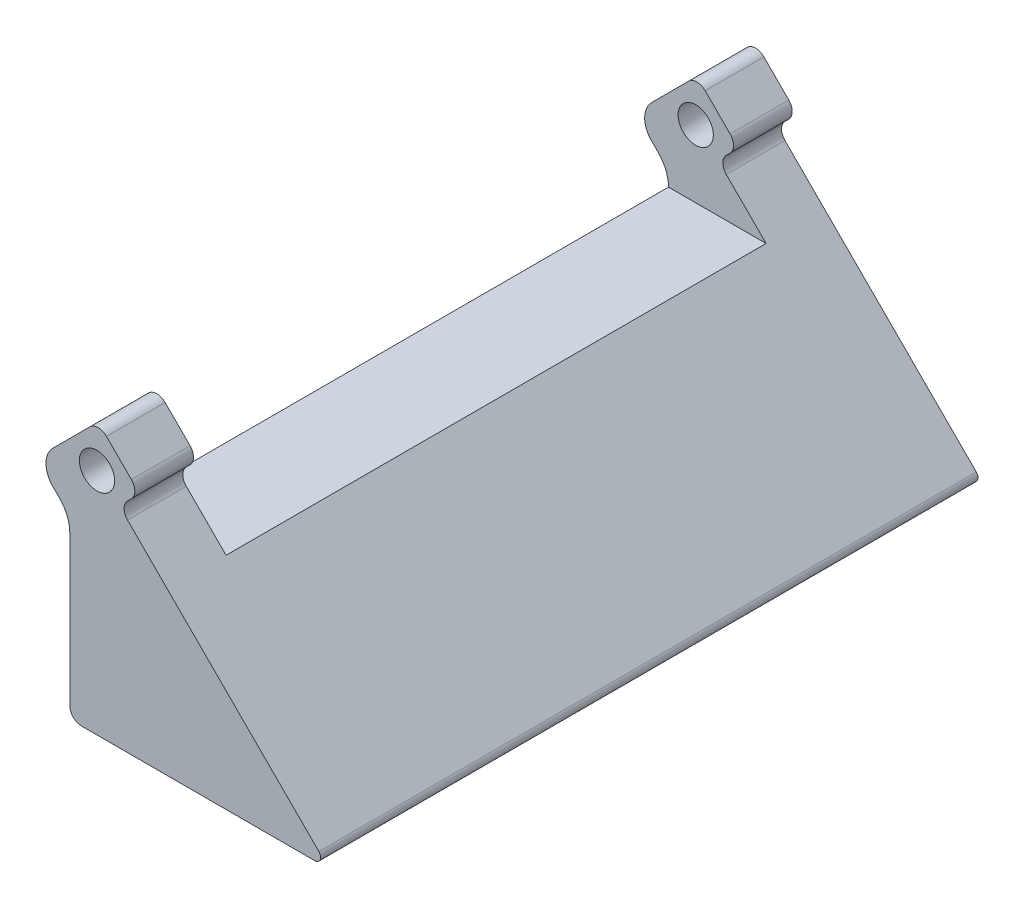
from build123d import *

# Parameters (mm, degrees)
SKETCH1_R           = 1.5
BOSS_EXTRUDE1_DEPTH = 5
BOSS_EXTRUDE2_DEPTH = 23


with BuildPart() as part:
    # Sketch1 → Boss-Extrude1 (new body)
    with BuildSketch(Plane.XY):
        with BuildLine():
            Line((-3.762452186, -3.055345405), (-3.196477247, -3.621320344))
            ThreePointArc((-3.196477247, -3.621320344), (-2.546158993, -4.59459039), (-2.31779759, -5.742640687))
            Line((-2.31779759, -5.742640687), (-2.31779759, -18.5))
            ThreePointArc((-2.31779759, -18.5), (-2.024904371, -19.207106781), (-1.31779759, -19.5))
            Line((-1.31779759, -19.5), (18.54616344, -19.5))
            ThreePointArc((18.54616344, -19.5), (19.008103207, -19.191341716), (18.899716831, -18.646446609))
            Line((18.899716831, -18.646446609), (2.601508845, -2.348238623))
            ThreePointArc((2.601508845, -2.348238623), (2.308615626, -1.641131842), (2.601508845, -0.934025061))
            Line((2.601508845, -0.934025061), (2.927422074, -0.608111832))
            ThreePointArc((2.927422074, -0.608111832), (3.220315293, 0.098994949), (2.927422074, 0.806101731))
            Line((2.927422074, 0.806101731), (0.806101731, 2.927422074))
            ThreePointArc((0.806101731, 2.927422074), (0.098994949, 3.220315293), (-0.608111832, 2.927422074))
            Line((-0.608111832, 2.927422074), (-1.641131842, 1.894402064))
            Line((-1.641131842, 1.894402064), (-3.762452186, -0.22691828))
            ThreePointArc((-3.762452186, -0.22691828), (-4.348238623, -1.641131842), (-3.762452186, -3.055345405))
        make_face()
        Circle(SKETCH1_R, mode=Mode.SUBTRACT)
    boss_extrude1 = extrude(amount=BOSS_EXTRUDE1_DEPTH)

    # Sketch2 → Boss-Extrude2 (add)
    with BuildSketch(Plane.XY.offset(5)):
        with BuildLine():
            Line((18.899716831, -18.646446609), (5.995910909, -5.742640687))
            Line((5.995910909, -5.742640687), (-2.31779759, -5.742640687))
            Line((-2.31779759, -5.742640687), (-2.31779759, -18.5))
            ThreePointArc((-2.31779759, -18.5), (-2.024904371, -19.207106781), (-1.31779759, -19.5))
            Line((-1.31779759, -19.5), (18.54616344, -19.5))
            ThreePointArc((18.54616344, -19.5), (19.008103207, -19.191341716), (18.899716831, -18.646446609))
        make_face()
    boss_extrude2 = extrude(amount=BOSS_EXTRUDE2_DEPTH)

    # Mirror1: Boss-Extrude1, Boss-Extrude2 across plane
    add(boss_extrude1.mirror(Plane.XY.offset(28)))
    add(boss_extrude2.mirror(Plane.XY.offset(28)))


solid = part.part
